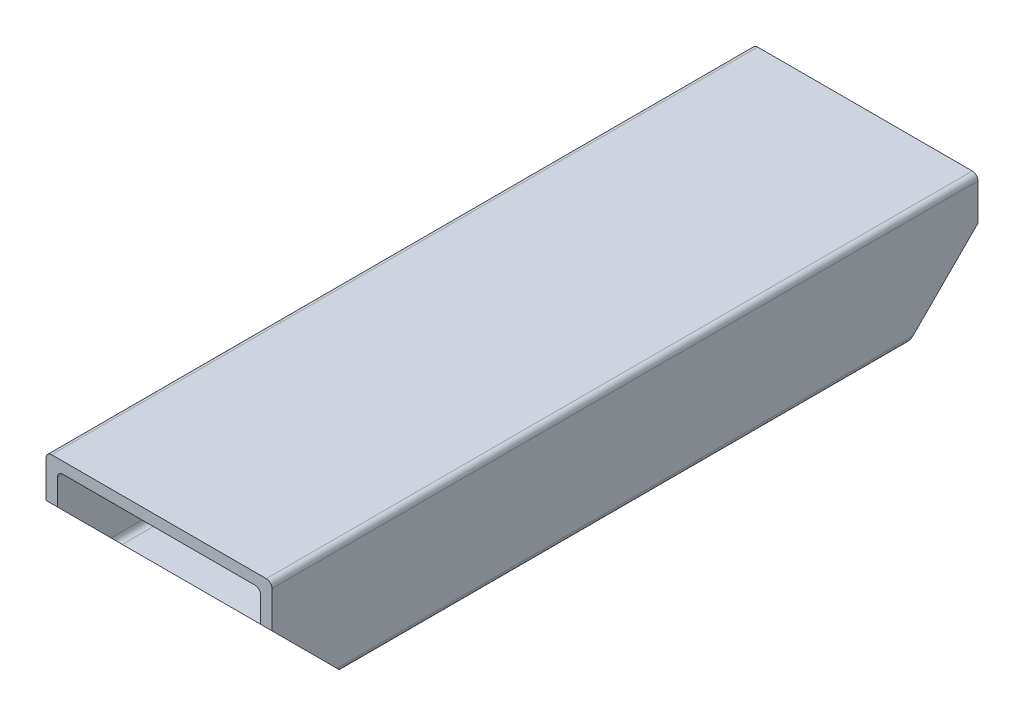
from build123d import *

# Parameters (mm, degrees)
BOSS_EXTRU_1_DEPTH      = 250
ENL_V_MAT_EXTRU_1_DEPTH = 266.518360947


with BuildPart() as part:
    # Esquisse2 → Boss.-Extru.1 (new body)
    with BuildSketch(Plane.XY):
        with BuildLine():
            Line((2, 0), (78, 0))
            ThreePointArc((78, 0), (79.414213562, 0.585786438), (80, 2))
            Line((80, 2), (80, 38))
            ThreePointArc((80, 38), (79.414213562, 39.414213562), (78, 40))
            Line((78, 40), (2, 40))
            ThreePointArc((2, 40), (0.585786438, 39.414213562), (0, 38))
            Line((0, 38), (0, 2))
            ThreePointArc((0, 2), (0.585786438, 0.585786438), (2, 0))
        make_face()
        with BuildLine():
            Line((6, 4), (74, 4))
            ThreePointArc((74, 4), (75.414213562, 4.585786438), (76, 6))
            Line((76, 6), (76, 34))
            ThreePointArc((76, 34), (75.414213562, 35.414213562), (74, 36))
            Line((74, 36), (6, 36))
            ThreePointArc((6, 36), (4.585786438, 35.414213562), (4, 34))
            Line((4, 34), (4, 6))
            ThreePointArc((4, 6), (4.585786438, 4.585786438), (6, 4))
        make_face(mode=Mode.SUBTRACT)
    extrude(amount=BOSS_EXTRU_1_DEPTH)

    # Esquisse3 → Enlèv. mat.-Extru.1 (cut, through all)
    with BuildSketch(Plane(origin=(80, 0, 0), x_dir=(0, 0, -1), z_dir=(1, 0, 0))):
        Polygon((0, 25), (-25, 0), (0, 0), align=None)
        Polygon((-250, 25), (-225, 0), (-250, 0), align=None)
    extrude(amount=-ENL_V_MAT_EXTRU_1_DEPTH, mode=Mode.SUBTRACT)


solid = part.part
